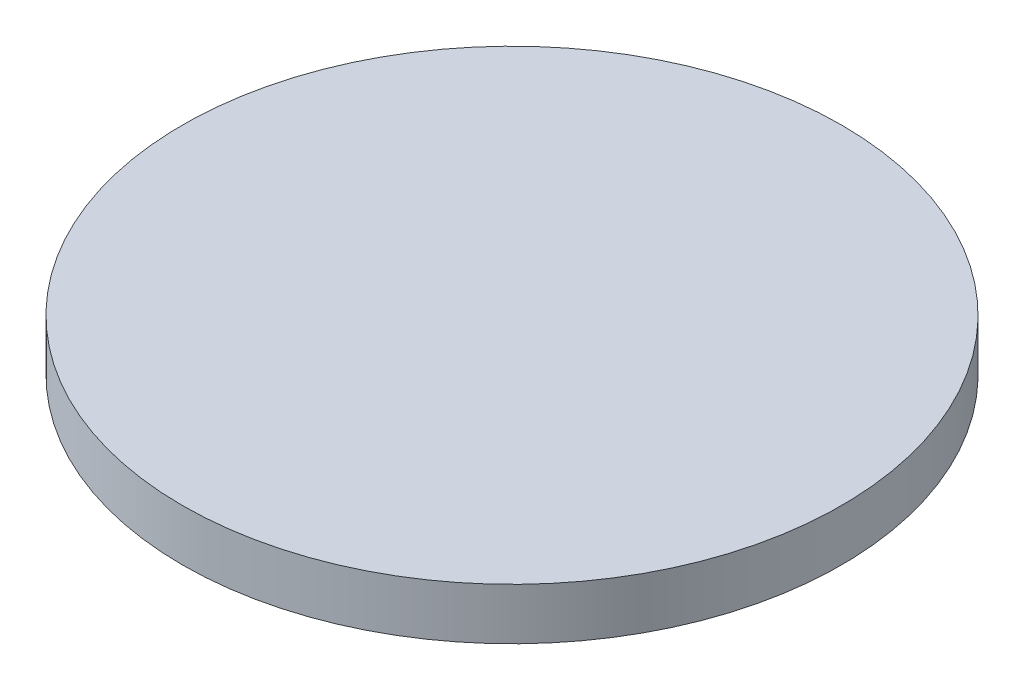
from build123d import *

# Parameters (mm, degrees)
SKETCH1_R           = 320
BOSS_EXTRUDE1_DEPTH = 50
SKETCH4_R           = 32.5
BOSS_EXTRUDE2_DEPTH = 15


with BuildPart() as part:
    # Sketch1 → Boss-Extrude1 (new body)
    with BuildSketch(Plane(origin=(0, 0, 0), x_dir=(1, 0, 0), z_dir=(0, 1, 0))):
        with Locations(Location((0, 0, 0), (0, 0, 270))):
            Circle(SKETCH1_R)
    extrude(amount=BOSS_EXTRUDE1_DEPTH)

    # Sketch4 → Boss-Extrude2 (add)
    with BuildSketch(Plane.XZ):
        with Locations(Location((0, 0, 0), (0, 0, 90))):
            Circle(SKETCH4_R)
    extrude(amount=BOSS_EXTRUDE2_DEPTH)


solid = part.part
